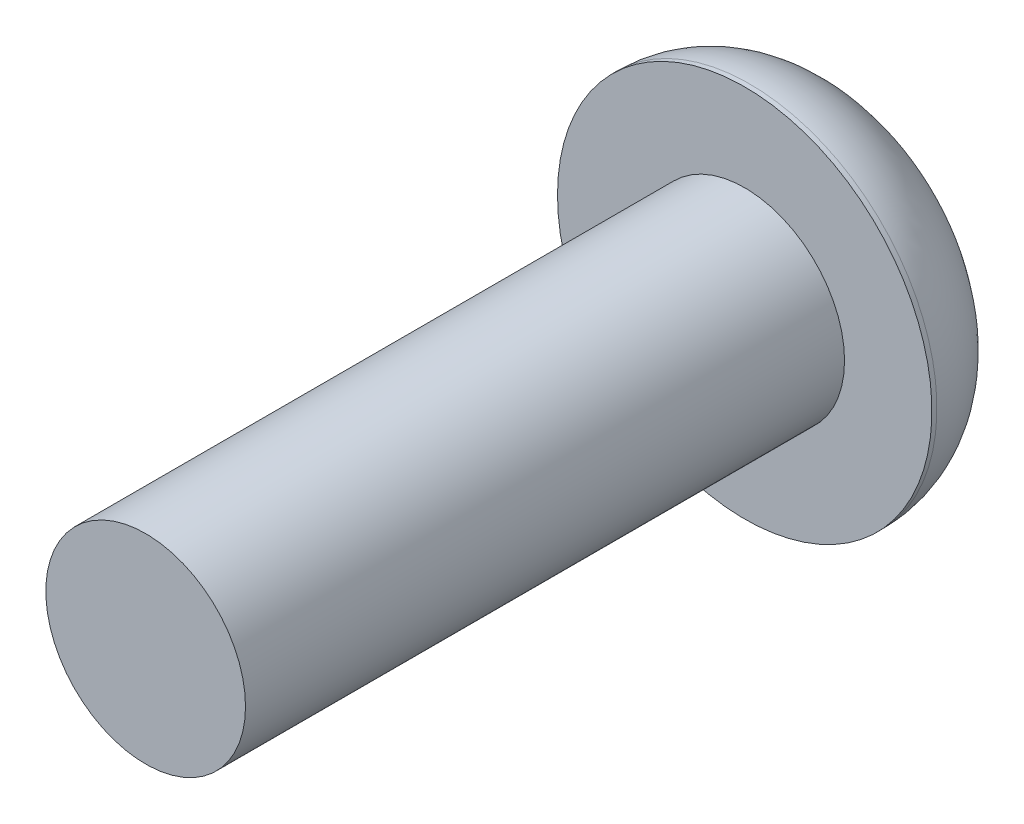
from build123d import *

# Parameters (mm, degrees)
SKETCH_1_R      = 2
EXTRUDE_1_DEPTH = 12
SKETCH_2_R      = 3.75
EXTRUDE_2_DEPTH = 2.1
FILLET_1_R      = 2


with BuildPart() as part:
    # 草图1 → 凸台-拉伸1 (new body)
    with BuildSketch(Plane.XY):
        Circle(SKETCH_1_R)
    extrude(amount=EXTRUDE_1_DEPTH)

    # 草图2 → 凸台-拉伸2 (add)
    with BuildSketch(Plane(origin=(0, 0, 0), x_dir=(-1, 0, 0), z_dir=(0, 0, -1))):
        Circle(SKETCH_2_R)
    extrude(amount=EXTRUDE_2_DEPTH)

    # 圆角1
    fillet_1_edges = [part.edges().sort_by_distance(p)[0] for p in [
        (3.75, 0, -2.1),
    ]]
    fillet(fillet_1_edges, radius=FILLET_1_R)


solid = part.part
